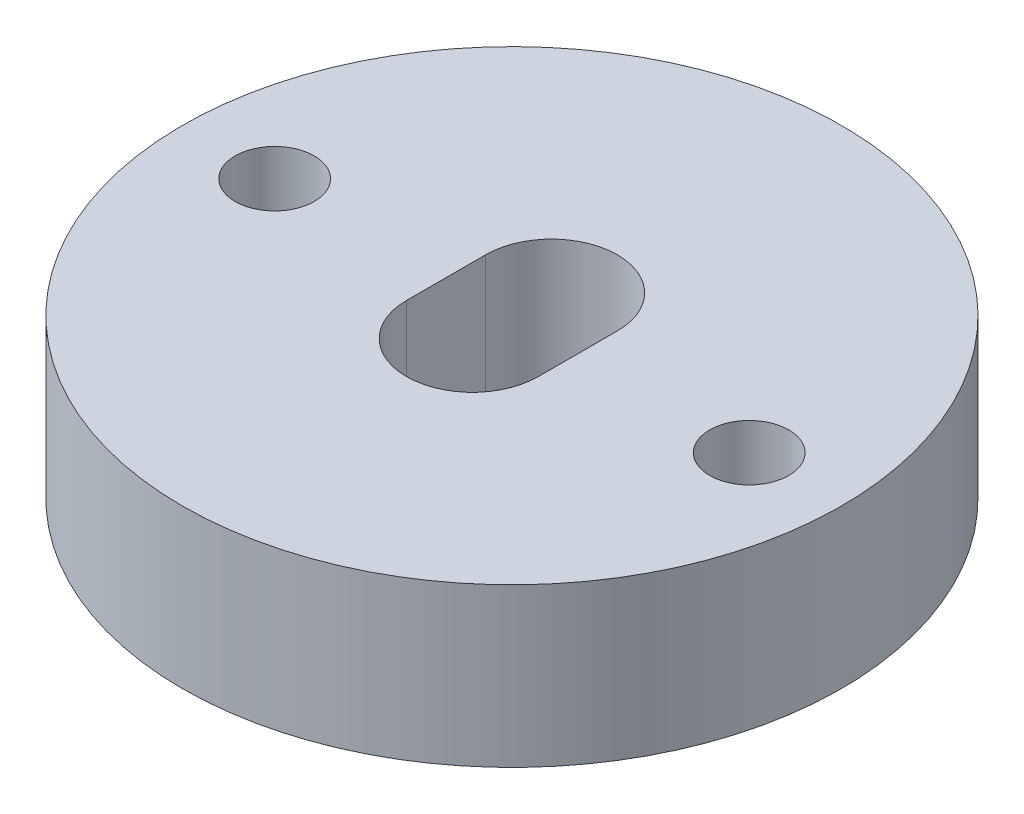
from build123d import *

# Parameters (mm, degrees)
SKETCH1_R           = 12.5
BOSS_EXTRUDE1_DEPTH = 6
CUT_EXTRUDE1_DEPTH  = 19.668154703
SKETCH3_R           = 1.5
CUT_EXTRUDE2_DEPTH  = 19.668154703


with BuildPart() as part:
    # Sketch1 → Boss-Extrude1 (new body)
    with BuildSketch(Plane(origin=(0, 0, 0), x_dir=(1, 0, 0), z_dir=(0, 1, 0))):
        with Locations(Location((0, 0, 0), (0, 0, 270))):
            Circle(SKETCH1_R)
    extrude(amount=BOSS_EXTRUDE1_DEPTH)

    # Sketch2 → Cut-Extrude1 (cut, through all)
    with BuildSketch(Plane(origin=(0, 6, 0), x_dir=(1, 0, 0), z_dir=(0, 1, 0))):
        with BuildLine():
            Line((-2.5, -1.5), (-2.5, 1.5))
            ThreePointArc((-2.5, 1.5), (0, 4), (2.5, 1.5))
            Line((2.5, 1.5), (2.5, -1.5))
            ThreePointArc((2.5, -1.5), (0, -4), (-2.5, -1.5))
        make_face()
    extrude(amount=-CUT_EXTRUDE1_DEPTH, mode=Mode.SUBTRACT)

    # Sketch3 → Cut-Extrude2 (cut, through all)
    with BuildSketch(Plane(origin=(0, 6, 0), x_dir=(1, 0, 0), z_dir=(0, 1, 0))):
        with Locations(Location((-9, 0, 0), (0, 0, 270))):
            Circle(SKETCH3_R)
        with Locations(Location((9, 0, 0), (0, 0, 90))):
            Circle(SKETCH3_R)
    extrude(amount=-CUT_EXTRUDE2_DEPTH, mode=Mode.SUBTRACT)


solid = part.part
